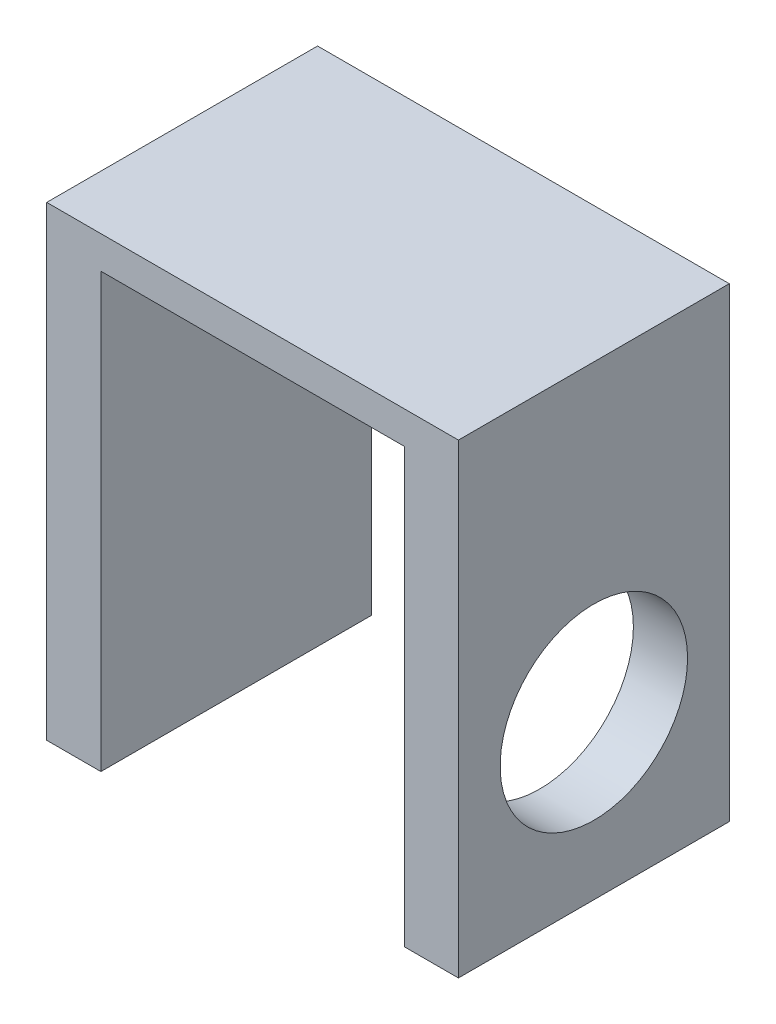
from build123d import *

# Parameters (mm, degrees)
SKETCH1_W                     = 76
SKETCH1_H                     = 50
UAV_INTERFACE_TOP_DEPTH       = 6
SKETCH2_W                     = 10
SKETCH2_H                     = 50
SPOOL_AND_MOTOR_INSERTS_DEPTH = 80
SKETCH3_R                     = 17.3
MOTOR_CUTOUT_DEPTH            = 30


with BuildPart() as part:
    # Sketch1 → UAV Interface Top (new body)
    with BuildSketch(Plane(origin=(0, 0, 0), x_dir=(1, 0, 0), z_dir=(0, 1, 0))):
        with Locations((38, 25)):
            Rectangle(SKETCH1_W, SKETCH1_H)
    extrude(amount=-UAV_INTERFACE_TOP_DEPTH)

    # Sketch2 → Spool and Motor Inserts (add)
    with BuildSketch(Plane.XZ.offset(6)):
        with Locations((71, -25)):
            Rectangle(SKETCH2_W, SKETCH2_H)
    extrude(amount=SPOOL_AND_MOTOR_INSERTS_DEPTH)

    # Mirror1: part across plane


with BuildPart() as part_1:
    add(part.part)
    add(part.part.mirror(Plane(origin=(38, 0, 0), x_dir=(0, 0, 1), z_dir=(1, 0, 0))))

    # Sketch3 → Motor Cutout (cut)
    with BuildSketch(Plane(origin=(76, 0, 0), x_dir=(0, 0, -1), z_dir=(1, 0, 0))):
        with Locations((25, -56)):
            Circle(SKETCH3_R)
    extrude(amount=-MOTOR_CUTOUT_DEPTH, mode=Mode.SUBTRACT)


solid = part_1.part
